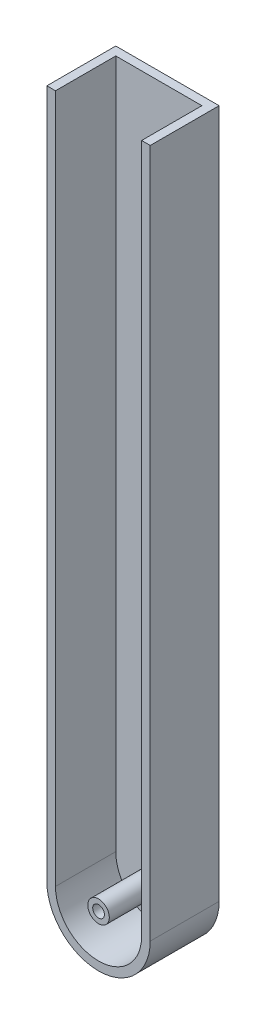
from build123d import *

# Parameters (mm, degrees)
SKETCH1_W           = 6.35
SKETCH1_H           = 50.8
SKETCH1_W_2         = 63.5
SKETCH1_H_2         = 6.35
BOSS_EXTRUDE1_DEPTH = 508
SKETCH2_W           = 31.75
SKETCH2_H           = 6.35
REVOLVE2_ANGLE      = 180
SKETCH3_R           = 7.929881475
BOSS_EXTRUDE2_DEPTH = 44.45
SKETCH4_R           = 4.30972172
CUT_EXTRUDE1_DEPTH  = 44.45


with BuildPart() as part:
    # Sketch1 → Boss-Extrude1 (new body)
    with BuildSketch(Plane(origin=(0, 0, 0), x_dir=(1, 0, 0), z_dir=(0, 1, 0))):
        with Locations((3.175, 25.4)):
            Rectangle(SKETCH1_W, SKETCH1_H)
        with Locations((38.1, 47.625)):
            Rectangle(SKETCH1_W_2, SKETCH1_H_2)
        Polygon((69.85, 50.8), (69.85, 44.45), (69.85, 0), (76.2, 0), (76.2, 50.8), align=None)
    extrude(amount=BOSS_EXTRUDE1_DEPTH)

    # Sketch2 → Revolve2 (revolve)
    with BuildSketch(Plane.XZ):
        with Locations((22.225, -47.625)):
            Rectangle(SKETCH2_W, SKETCH2_H)
        Polygon((6.35, 0), (0, 0), (0, -50.8), (6.35, -50.8), (6.35, -44.45), align=None)
    revolve(axis=Axis((38.1, 0, -50.8), (0, 0, 1)), revolution_arc=REVOLVE2_ANGLE)

    # Sketch3 → Boss-Extrude2 (add)
    with BuildSketch(Plane.XY.offset(-44.45)):
        with Locations(Location((38.1, 0, 0), (0, 0, 180))):
            Circle(SKETCH3_R)
    extrude(amount=BOSS_EXTRUDE2_DEPTH)

    # Sketch4 → Cut-Extrude1 (cut)
    with BuildSketch(Plane.XY):
        with Locations((38.1, 0)):
            Circle(SKETCH4_R)
    extrude(amount=-CUT_EXTRUDE1_DEPTH, mode=Mode.SUBTRACT)


solid = part.part
